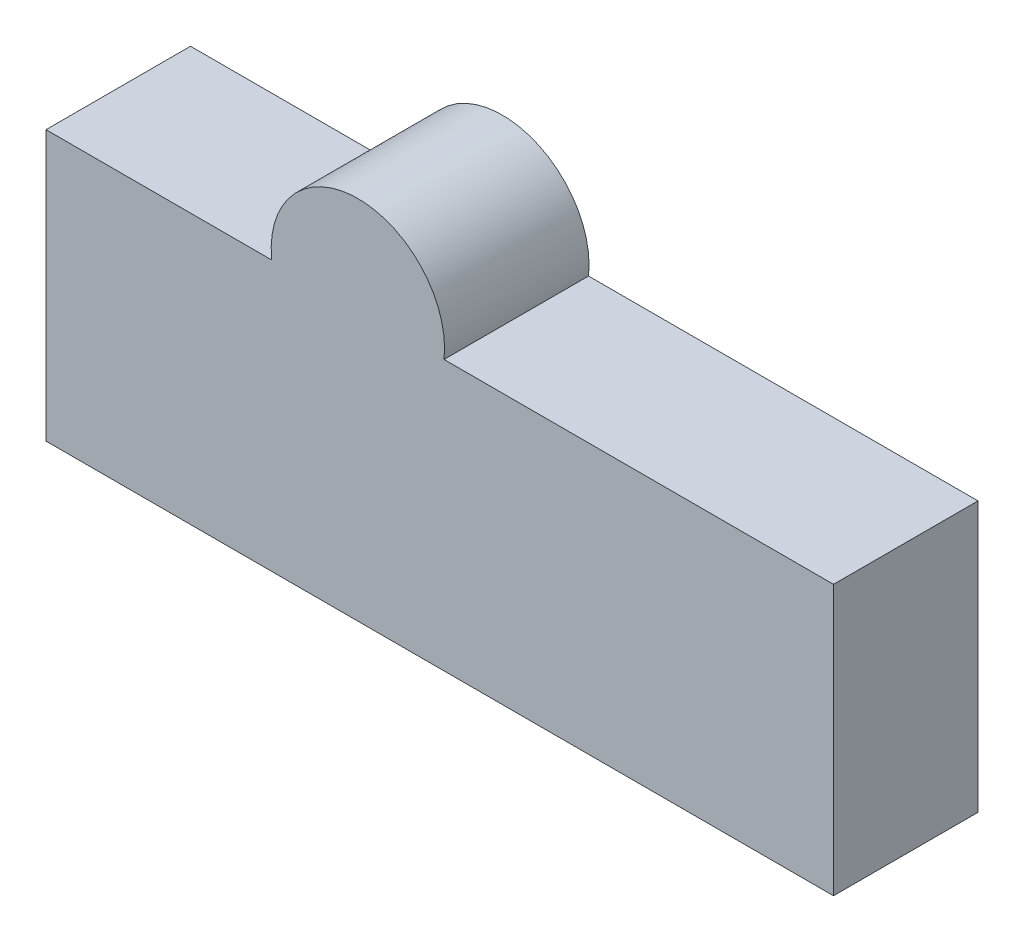
from build123d import *

# Parameters (mm, degrees)
BOSS_EXTRUDE1_DEPTH = 1.5


with BuildPart() as part:
    # Sketch1 → Boss-Extrude1 (new body)
    with BuildSketch(Plane.XY):
        with BuildLine():
            Line((11.425, -5.153774243), (13.768072809, -5.153774243))
            ThreePointArc((13.768072809, -5.153774243), (14.6625, -4.153774243), (15.556927191, -5.153774243))
            Line((15.556927191, -5.153774243), (19.6, -5.153774243))
            Line((19.6, -5.153774243), (19.6, -7.953774243))
            Line((19.6, -7.953774243), (11.425, -7.953774243))
            Line((11.425, -7.953774243), (11.425, -5.153774243))
        make_face()
    extrude(amount=BOSS_EXTRUDE1_DEPTH)


solid = part.part
